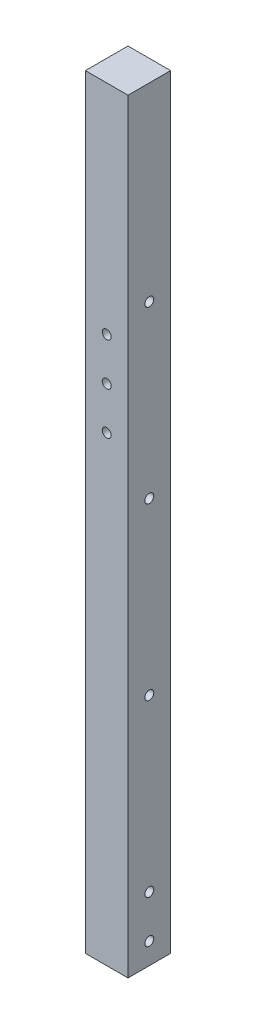
from build123d import *

# Parameters (mm, degrees)
SKETCH_1_W          = 20
SKETCH_1_H          = 20
EXTRUDE_1_DEPTH     = 358.95
SKETCH_2_R          = 2.1
CUT_EXTRUDE_1_DEPTH = 360.645801449
SKETCH_3_R          = 2.1
CUT_EXTRUDE_2_DEPTH = 360.645801449


with BuildPart() as part:
    # 草图1 → 凸台-拉伸1 (new body)
    with BuildSketch(Plane(origin=(0, 0, 0), x_dir=(1, 0, 0), z_dir=(0, 1, 0))):
        Rectangle(SKETCH_1_W, SKETCH_1_H)
    extrude(amount=EXTRUDE_1_DEPTH)

    # 草图2 → 切除-拉伸1 (cut, through all)
    with BuildSketch(Plane(origin=(10, 0, 0), x_dir=(0, 0, -1), z_dir=(1, 0, 0))):
        with Locations((0, 10)):
            Circle(SKETCH_2_R)
        with Locations((0, 30)):
            Circle(SKETCH_2_R)
        with Locations((0, 110)):
            Circle(SKETCH_2_R)
        with Locations((0, 190)):
            Circle(SKETCH_2_R)
        with Locations((0, 270)):
            Circle(SKETCH_2_R)
    extrude(amount=-CUT_EXTRUDE_1_DEPTH, mode=Mode.SUBTRACT)

    # 草图3 → 切除-拉伸2 (cut, through all)
    with BuildSketch(Plane(origin=(0, 0, -10), x_dir=(-1, 0, 0), z_dir=(0, 0, -1))):
        with Locations((0, 216.69)):
            Circle(SKETCH_3_R)
        with Locations((0, 236.69)):
            Circle(SKETCH_3_R)
        with Locations((0, 256.69)):
            Circle(SKETCH_3_R)
    extrude(amount=-CUT_EXTRUDE_2_DEPTH, mode=Mode.SUBTRACT)


solid = part.part
